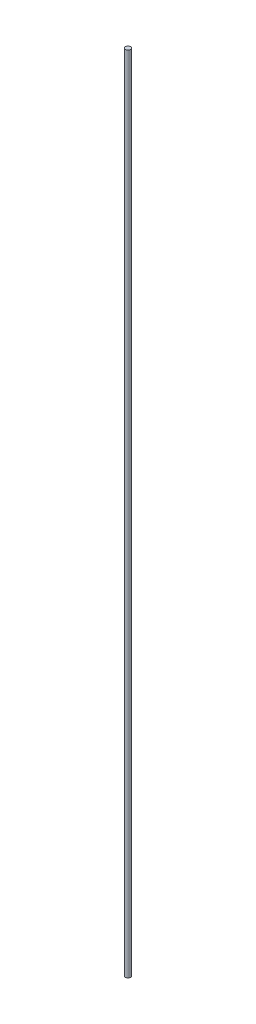
from build123d import *

# Parameters (mm, degrees)
SKETCH1_R           = 12.7
BOSS_EXTRUDE1_DEPTH = 3989.822670059


with BuildPart() as part:
    # Sketch1 → Boss-Extrude1 (new body)
    with BuildSketch(Plane(origin=(0, 0, 0), x_dir=(1, 0, 0), z_dir=(0, 1, 0))):
        with Locations(Location((0, 0, 0), (0, 0, 90))):
            Circle(SKETCH1_R)
    extrude(amount=BOSS_EXTRUDE1_DEPTH)


solid = part.part
